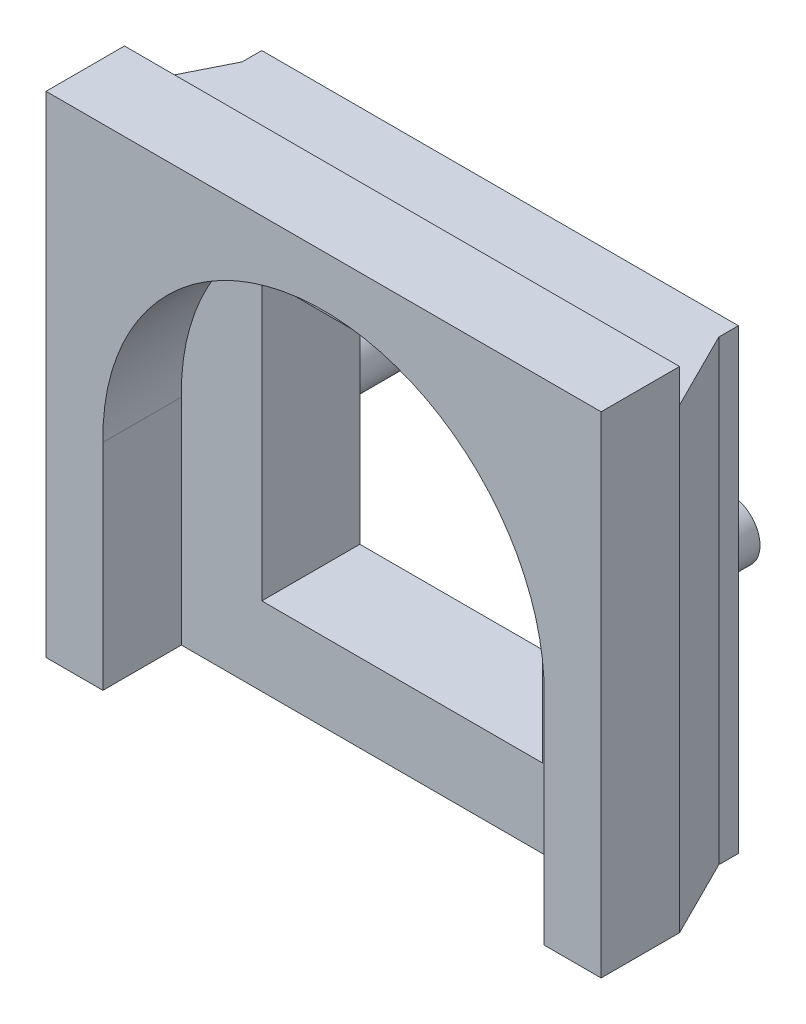
from build123d import *

# Parameters (mm, degrees)
SKETCH1_W                       = 24.3
SKETCH1_H                       = 24.3
SKETCH1_W_2                     = 14.3
SKETCH1_H_2                     = 14.3
BOSS_EXTRUDE1_DEPTH             = 4
SKETCH3_R                       = 1.5
BOSS_EXTRUDE4_DEPTH             = 4
BOSS_EXTRUDE5_DEPTH             = 4
BOSS_EXTRUDE6_REACH             = 23.355
BOSS_EXTRUDE6_DIRECTION_2_REACH = 23.355
CUT_EXTRUDE1_DEPTH              = 11
SKETCH7_W                       = 24.3
SKETCH7_H                       = 23.3
SKETCH7_W_2                     = 14.3
SKETCH7_H_2                     = 14.3
BOSS_EXTRUDE8_DEPTH             = 1


with BuildPart() as part:
    # Sketch1 → Boss-Extrude1 (new body)
    with BuildSketch(Plane.XY):
        Rectangle(SKETCH1_W, SKETCH1_H)
        Rectangle(SKETCH1_W_2, SKETCH1_H_2, mode=Mode.SUBTRACT)
    extrude(amount=BOSS_EXTRUDE1_DEPTH)

    # Sketch3 → Boss-Extrude4 (add)
    with BuildSketch(Plane(origin=(0, 0, 0), x_dir=(-1, 0, 0), z_dir=(0, 0, -1))):
        with Locations(Location((8.75, 0, 0), (0, 0, 180))):
            Circle(SKETCH3_R)
        with Locations(Location((-8.75, 0, 0), (0, 0, 180))):
            Circle(SKETCH3_R)
    extrude(amount=BOSS_EXTRUDE4_DEPTH)

    # Sketch4 → Boss-Extrude5 (add)
    with BuildSketch(Plane.XY.offset(4)):
        with BuildLine():
            Line((11.248190336, -0.201777492), (11.248190336, -11.15))
            Line((11.248190336, -11.15), (14.15, -11.15))
            Line((14.15, -11.15), (14.15, 13.85))
            Line((14.15, 13.85), (-14.15, 13.85))
            Line((-14.15, 13.85), (-14.15, -11.15))
            Line((-14.15, -11.15), (-11.248190336, -11.15))
            Line((-11.248190336, -11.15), (-11.248190336, -0.201777492))
            ThreePointArc((-11.248190336, -0.201777492), (0, 11.25), (11.248190336, -0.201777492))
        make_face()
    extrude(amount=BOSS_EXTRUDE5_DEPTH)

    # Boss-Extrude6: up to this face of the body (flat: up to its plane)
    boss_extrude6_end = Plane(part.part.faces().sort_by_distance((0, 12.15, 2))[0])
    # Sketch5 → Boss-Extrude6 (add, up to the picked face)
    with BuildSketch(Plane(origin=(0, 0, 0), x_dir=(1, 0, 0), z_dir=(0, 1, 0)), mode=Mode.PRIVATE) as boss_extrude6_sk1:
        Polygon((-12.15, 0), (-14.15, -4), (-12.15, -4), align=None)
    boss_extrude6_tool1 = split(extrude(boss_extrude6_sk1.sketch, amount=BOSS_EXTRUDE6_REACH, mode=Mode.PRIVATE), bisect_by=boss_extrude6_end, keep=Keep.BOTH, mode=Mode.PRIVATE)
    # Sketch5 → Boss-Extrude6 (add, up to the picked face)
    with BuildSketch(Plane(origin=(0, 0, 0), x_dir=(1, 0, 0), z_dir=(0, 1, 0)), mode=Mode.PRIVATE) as boss_extrude6_sk2:
        Polygon((12.15, 0), (12.15, -4), (14.15, -4), align=None)
    boss_extrude6_tool2 = split(extrude(boss_extrude6_sk2.sketch, amount=BOSS_EXTRUDE6_REACH, mode=Mode.PRIVATE), bisect_by=boss_extrude6_end, keep=Keep.BOTH, mode=Mode.PRIVATE)
    add(boss_extrude6_tool1.solids().sort_by(Axis((-12.816667, 0, 2.666667), (0, 1, 0)))[0])
    add(boss_extrude6_tool2.solids().sort_by(Axis((12.816667, 0, 2.666667), (0, 1, 0)))[0])

    # Boss-Extrude6 direction 2: up to this face of the body (flat: up to its plane)
    boss_extrude6_direction_2_end = Plane(part.part.faces().sort_by_distance((12.699095168, -11.15, 6))[0])
    # Sketch5 → Boss-Extrude6 direction 2 (add, up to the picked face)
    with BuildSketch(Plane(origin=(0, 0, 0), x_dir=(1, 0, 0), z_dir=(0, 1, 0)), mode=Mode.PRIVATE) as boss_extrude6_direction_2_sk1:
        Polygon((-12.15, 0), (-14.15, -4), (-12.15, -4), align=None)
    boss_extrude6_direction_2_tool1 = split(extrude(boss_extrude6_direction_2_sk1.sketch, amount=-BOSS_EXTRUDE6_DIRECTION_2_REACH, mode=Mode.PRIVATE), bisect_by=boss_extrude6_direction_2_end, keep=Keep.BOTH, mode=Mode.PRIVATE)
    # Sketch5 → Boss-Extrude6 direction 2 (add, up to the picked face)
    with BuildSketch(Plane(origin=(0, 0, 0), x_dir=(1, 0, 0), z_dir=(0, 1, 0)), mode=Mode.PRIVATE) as boss_extrude6_direction_2_sk2:
        Polygon((12.15, 0), (12.15, -4), (14.15, -4), align=None)
    boss_extrude6_direction_2_tool2 = split(extrude(boss_extrude6_direction_2_sk2.sketch, amount=-BOSS_EXTRUDE6_DIRECTION_2_REACH, mode=Mode.PRIVATE), bisect_by=boss_extrude6_direction_2_end, keep=Keep.BOTH, mode=Mode.PRIVATE)
    add(boss_extrude6_direction_2_tool1.solids().sort_by(Axis((-12.816667, 0, 2.666667), (0, -1, 0)))[0])
    add(boss_extrude6_direction_2_tool2.solids().sort_by(Axis((12.816667, 0, 2.666667), (0, -1, 0)))[0])

    # Sketch6 → Cut-Extrude1 (cut)
    with BuildSketch(Plane.XY.offset(4)):
        Polygon((-14.15, -11.15), (-17.465023318, -11.15), (-17.465023318, -14.474968539), (16.848397365, -14.474968539), (16.848397365, -10.738940706), (14.15, -11.15), align=None)
    extrude(amount=-CUT_EXTRUDE1_DEPTH, mode=Mode.SUBTRACT)

    # Sketch7 → Boss-Extrude8 (add)
    with BuildSketch(Plane(origin=(0, 0, 0), x_dir=(-1, 0, 0), z_dir=(0, 0, -1))):
        with Locations((0, 0.5)):
            Rectangle(SKETCH7_W, SKETCH7_H)
        Rectangle(SKETCH7_W_2, SKETCH7_H_2, mode=Mode.SUBTRACT)
    extrude(amount=BOSS_EXTRUDE8_DEPTH)


solid = part.part
